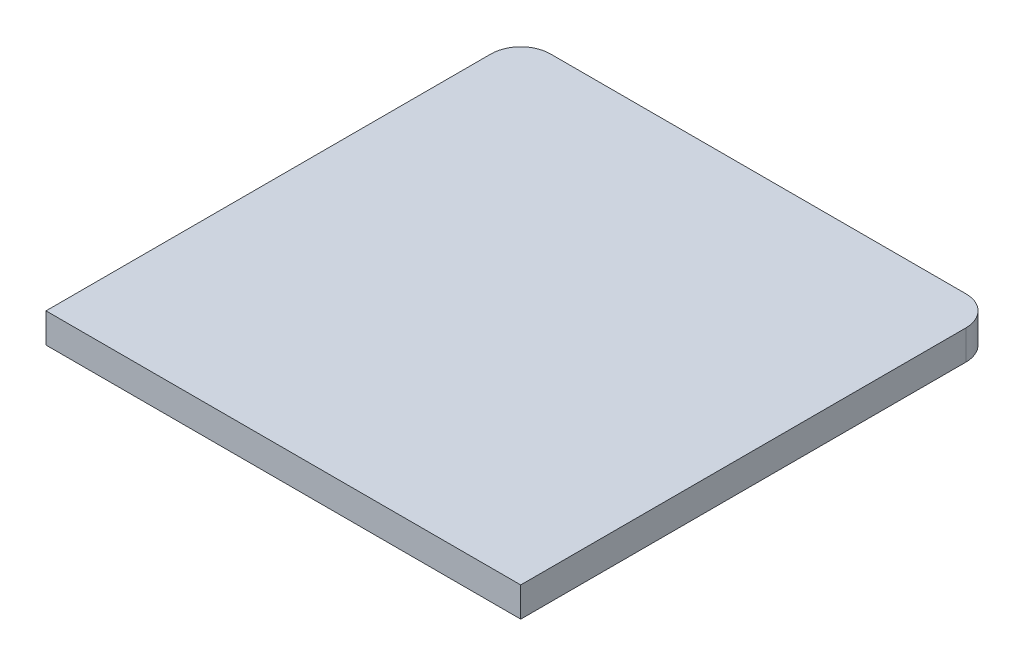
from build123d import *

# Parameters (mm, degrees)
SKETCH1_W           = 50.8
SKETCH1_H           = 50.8
BOSS_EXTRUDE1_DEPTH = 3.175
FILLET1_R           = 3.175


with BuildPart() as part:
    # Sketch1 → Boss-Extrude1 (new body)
    with BuildSketch(Plane(origin=(0, 0, 0), x_dir=(1, 0, 0), z_dir=(0, 1, 0))):
        with Locations((25.4, 25.4)):
            Rectangle(SKETCH1_W, SKETCH1_H)
    extrude(amount=BOSS_EXTRUDE1_DEPTH)

    # Fillet1
    fillet1_edges = [part.edges().sort_by_distance(p)[0] for p in [
        (0, 1.5875, -50.8),
        (50.8, 1.5875, -50.8),
    ]]
    fillet(fillet1_edges, radius=FILLET1_R)


solid = part.part
